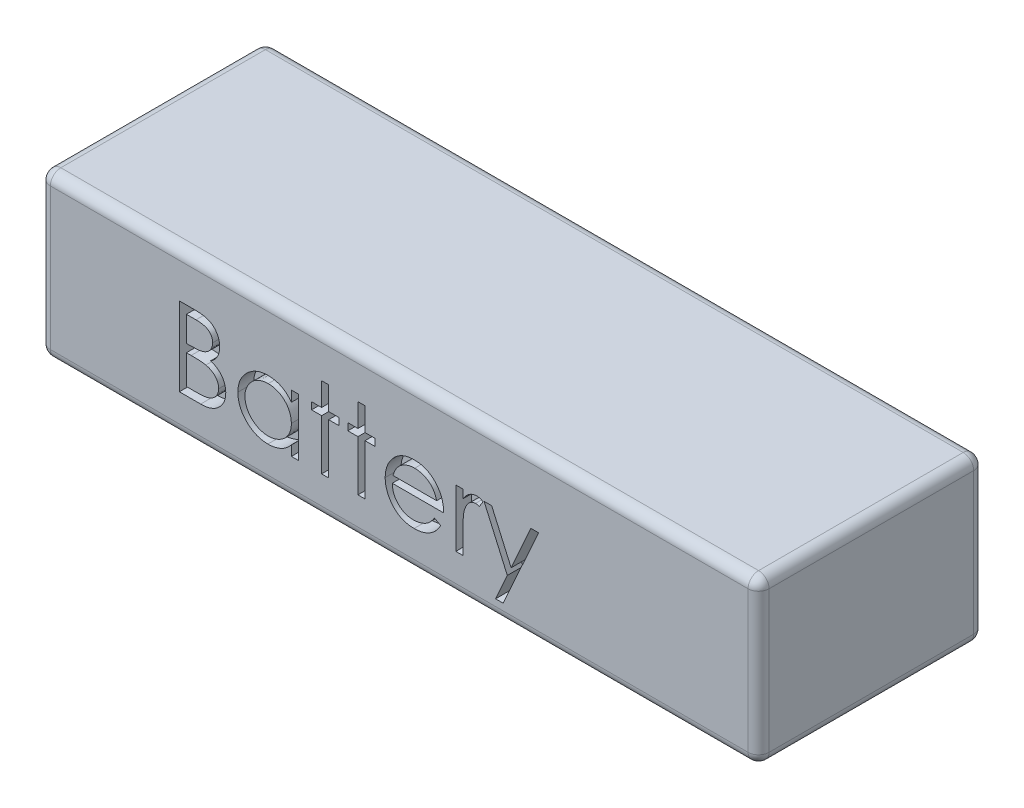
from build123d import *

# Parameters (mm, degrees)
SKETCH1_W           = 137
SKETCH1_H           = 43
BOSS_EXTRUDE1_DEPTH = 31
CUT_EXTRUDE1_DEPTH  = 3
CUT_EXTRUDE2_DEPTH  = 3
FILLET1_R           = 2


with BuildPart() as part:
    # Sketch1 → Boss-Extrude1 (new body)
    with BuildSketch(Plane(origin=(0, 0, 0), x_dir=(1, 0, 0), z_dir=(0, 1, 0))):
        with Locations((68.5, 21.5)):
            Rectangle(SKETCH1_W, SKETCH1_H)
    extrude(amount=BOSS_EXTRUDE1_DEPTH)

    # Sketch3 → Cut-Extrude1 (cut)
    # profile 1 of 7: a face of its own
    with BuildSketch(Plane.XY):
        with BuildLine():
            Line((26.597376063, 22.317205952), (29.524058756, 22.317205952))
            add(Edge.make_bspline(
                [(29.524058756, 22.317205952), (29.667323662, 22.316452736), (29.945006707, 22.314992816), (30.348804314, 22.292350825), (30.727013503, 22.261477954), (31.079743956, 22.212491843), (31.40683268, 22.153384227), (31.709265411, 22.081805015), (31.986080435, 21.995976671), (32.316563591, 21.859492608), (32.693366424, 21.65667903), (33.101359535, 21.356985179), (33.450234847, 20.99041748), (33.751033349, 20.576920385), (33.990181005, 20.122052792), (34.163192279, 19.636656269), (34.27272603, 19.12699166), (34.283990749, 18.777092327), (34.289683756, 18.600258837)],
                knots=[0, 0, 0, 0, 1.001505555, 1.941167018, 2.826882275, 3.653841531, 4.429895133, 5.150066043, 5.825578002, 6.45369114, 7.647487171, 8.808567382, 9.977351308, 11.170798116, 12.373658725, 13.556498008, 14.765093433, 16, 16, 16, 16], degree=3))
            add(Edge.make_bspline(
                [(34.289683756, 18.600258837), (34.284998534, 18.434605027), (34.275791631, 18.109079668), (34.187751234, 17.632962057), (34.049919798, 17.179742547), (33.858325873, 16.751075181), (33.609317318, 16.356645411), (33.314210238, 15.993271413), (32.958166798, 15.676338312), (32.691410055, 15.499154444), (32.555909717, 15.409153067)],
                knots=[0, 0, 0, 0, 1.044552857, 2.05264487, 3.044412934, 4.028983338, 5.005914585, 5.980388656, 6.974128949, 8, 8, 8, 8], degree=3))
            add(Edge.make_bspline(
                [(32.555909717, 15.409153067), (32.72631155, 15.343731643), (33.052332467, 15.218564253), (33.500986806, 14.997269407), (33.887536142, 14.756574649), (34.214952482, 14.493723862), (34.494971003, 14.210400387), (34.73948361, 13.902449898), (34.94811807, 13.565855221), (35.126887743, 13.204125784), (35.266382411, 12.820955205), (35.370850573, 12.419937593), (35.430711069, 12.002510928), (35.439229532, 11.718430731), (35.44352991, 11.575018452)],
                knots=[0, 0, 0, 0, 1.27268992, 2.434971085, 3.483601985, 4.442670788, 5.356604649, 6.2567628, 7.179492994, 8.113709626, 9.066344395, 10.018646069, 10.999752585, 12, 12, 12, 12], degree=3))
            add(Edge.make_bspline(
                [(35.44352991, 11.575018452), (35.439343427, 11.428589), (35.431106404, 11.140484951), (35.370335096, 10.71724866), (35.267438924, 10.312784603), (35.125705439, 9.924476677), (34.940724091, 9.553076101), (34.715604244, 9.198162112), (34.447183257, 8.863300696), (34.146913818, 8.544770882), (33.807218909, 8.258366079), (33.440722817, 8.003298765), (33.042810017, 7.793529927), (32.620015757, 7.617318407), (32.167597259, 7.482716128), (31.687586085, 7.388547954), (31.18039622, 7.325097795), (30.83235443, 7.319881203), (30.653866448, 7.317205952)],
                knots=[0, 0, 0, 0, 0.978564426, 1.925352924, 2.850884081, 3.763762016, 4.682927383, 5.618979971, 6.567305752, 7.547517671, 8.540179244, 9.531824382, 10.526200242, 11.540722885, 12.589160233, 13.674978461, 14.80764778, 16, 16, 16, 16], degree=3))
            Line((30.653866448, 7.317205952), (26.597376063, 7.317205952))
            Line((26.597376063, 7.317205952), (26.597376063, 22.317205952))
        make_face()
        with BuildLine():
            Line((27.94352991, 20.778744413), (27.94352991, 15.971052106))
            Line((27.94352991, 15.971052106), (28.847977025, 15.971052106))
            add(Edge.make_bspline(
                [(28.847977025, 15.971052106), (28.980186148, 15.972766062), (29.235641116, 15.976077773), (29.60558353, 15.985564275), (29.948976465, 16.012127318), (30.265227178, 16.038682727), (30.553837652, 16.081859531), (30.814168487, 16.133254344), (31.050305331, 16.187609651), (31.322617669, 16.280050309), (31.631501734, 16.416668917), (31.960786466, 16.628691072), (32.25107705, 16.881224015), (32.496207855, 17.172613851), (32.696828443, 17.493468933), (32.836172936, 17.838669849), (32.930661297, 18.199613272), (32.939196432, 18.447405784), (32.94352991, 18.573215567)],
                knots=[0, 0, 0, 0, 1.156816544, 2.235205308, 3.236616184, 4.169592532, 5.011045266, 5.787822928, 6.49130361, 7.128639758, 8.301311294, 9.436451833, 10.541879658, 11.654887649, 12.756523258, 13.837046038, 14.901820046, 16, 16, 16, 16], degree=3))
            add(Edge.make_bspline(
                [(32.94352991, 18.573215567), (32.941274852, 18.656468874), (32.936851309, 18.819779326), (32.90062287, 19.057847986), (32.83904755, 19.281749783), (32.759957722, 19.494553113), (32.649434771, 19.689603899), (32.519305642, 19.873646167), (32.362081255, 20.040412389), (32.183121344, 20.196281667), (31.977370103, 20.334472501), (31.744950281, 20.455504343), (31.482717379, 20.552964814), (31.195090858, 20.638319754), (30.87764334, 20.698269584), (30.534038111, 20.748212674), (30.161460744, 20.773638711), (29.903696019, 20.777004552), (29.770452986, 20.778744413)],
                knots=[0, 0, 0, 0, 0.91205012, 1.789085906, 2.630437955, 3.453916878, 4.269457761, 5.079663411, 5.91843418, 6.774407191, 7.675494373, 8.627863946, 9.638891023, 10.736472738, 11.911756761, 13.175263542, 14.539845004, 16, 16, 16, 16], degree=3))
            Line((29.770452986, 20.778744413), (27.94352991, 20.778744413))
        make_face(mode=Mode.SUBTRACT)
        with BuildLine():
            Line((27.94352991, 14.432590567), (27.94352991, 8.85566749))
            Line((27.94352991, 8.85566749), (29.860597217, 8.85566749))
            add(Edge.make_bspline(
                [(29.860597217, 8.85566749), (29.997821185, 8.857312122), (30.262302294, 8.860481933), (30.644164708, 8.870830024), (30.998092296, 8.894368348), (31.322470021, 8.93142199), (31.620800532, 8.971615343), (31.889504974, 9.02566369), (32.130761517, 9.087587807), (32.41050855, 9.183305688), (32.725523586, 9.332004849), (33.064998684, 9.556208676), (33.366825334, 9.823308567), (33.623133587, 10.132441056), (33.833189253, 10.468575314), (33.985998346, 10.824912528), (34.080244875, 11.195564789), (34.091654171, 11.448279271), (34.097376063, 11.575018452)],
                knots=[0, 0, 0, 0, 1.160039823, 2.235823828, 3.228722157, 4.157150951, 4.99529583, 5.772374946, 6.472645482, 7.099169577, 8.269452708, 9.405989375, 10.527446681, 11.663510218, 12.788923519, 13.866172445, 14.929861265, 16, 16, 16, 16], degree=3))
            add(Edge.make_bspline(
                [(34.097376063, 11.575018452), (34.096192759, 11.654275626), (34.093845237, 11.811511548), (34.058442602, 12.042579344), (34.006954589, 12.266404515), (33.9403913, 12.483594832), (33.843450727, 12.690223588), (33.73027982, 12.890377414), (33.597588099, 13.084320897), (33.390827388, 13.329516269), (33.090090311, 13.612017753), (32.662775559, 13.888607049), (32.176894282, 14.111669079), (31.824490741, 14.20638112), (31.642448179, 14.255306913)],
                knots=[0, 0, 0, 0, 0.723448775, 1.435228256, 2.130040452, 2.821711965, 3.505591119, 4.210454504, 4.921174351, 5.648778258, 7.137944449, 8.670945889, 10.280296675, 12, 12, 12, 12], degree=3))
            add(Edge.make_bspline(
                [(31.642448179, 14.255306913), (31.569466339, 14.270114416), (31.411226658, 14.302220136), (31.15319417, 14.336110294), (30.858611875, 14.366303407), (30.526799544, 14.38863694), (30.157337368, 14.411722127), (29.749436288, 14.420699932), (29.304762082, 14.431411046), (28.996223343, 14.432187336), (28.835957794, 14.432590567)],
                knots=[0, 0, 0, 0, 0.634451884, 1.375622551, 2.216452059, 3.157844607, 4.20941857, 5.370758133, 6.634282058, 8, 8, 8, 8], degree=3))
            Line((28.835957794, 14.432590567), (27.94352991, 14.432590567))
        make_face(mode=Mode.SUBTRACT)
    # profile 2 of 7: a face of its own
    with BuildSketch(Plane.XY):
        with BuildLine():
            Line((49.289683756, 18.278744413), (49.289683756, 7.317205952))
            Line((49.289683756, 7.317205952), (47.94352991, 7.317205952))
            Line((47.94352991, 7.317205952), (47.94352991, 9.213239606))
            add(Edge.make_bspline(
                [(47.94352991, 9.213239606), (47.791735093, 9.041641346), (47.495505599, 8.706765184), (47.00075795, 8.269270159), (46.476322902, 7.907648781), (45.924745811, 7.615577714), (45.346524768, 7.396183187), (44.742941537, 7.240242505), (44.113749905, 7.139983211), (43.684096956, 7.129971689), (43.466366448, 7.12489826)],
                knots=[0, 0, 0, 0, 1.074387032, 2.096679803, 3.090159297, 4.057316773, 5.018401886, 5.985159533, 6.978961417, 8, 8, 8, 8], degree=3))
            add(Edge.make_bspline(
                [(43.466366448, 7.12489826), (43.272789503, 7.130154141), (42.891047196, 7.140518971), (42.329494009, 7.220928844), (41.789098654, 7.350060079), (41.269350485, 7.52963532), (40.773612719, 7.767838841), (40.297640876, 8.053015619), (39.843900768, 8.392619176), (39.419308458, 8.780853583), (39.02831417, 9.202546386), (38.685194431, 9.652313015), (38.399109803, 10.128208603), (38.159880885, 10.624207834), (37.975610838, 11.144128918), (37.847152405, 11.686173923), (37.766836205, 12.249701953), (37.756475659, 12.633442766), (37.751222217, 12.82802326)],
                knots=[0, 0, 0, 0, 1.033919861, 2.038935746, 3.024066025, 3.998881131, 4.97069526, 5.957263378, 6.95902576, 7.993208707, 9.027059324, 10.027763471, 11.009749337, 11.988697705, 12.965288445, 13.950418724, 14.960734635, 16, 16, 16, 16], degree=3))
            add(Edge.make_bspline(
                [(37.751222217, 12.82802326), (37.756592095, 13.018581989), (37.767208052, 13.395306318), (37.84629328, 13.949357881), (37.979283317, 14.483007569), (38.16591695, 14.994537326), (38.405239614, 15.484566112), (38.696359987, 15.953440505), (39.039299093, 16.402452209), (39.434666552, 16.821043181), (39.862958424, 17.207702956), (40.321138699, 17.543741722), (40.797809905, 17.833956789), (41.300365664, 18.063900259), (41.821367542, 18.249939278), (42.365453738, 18.378651999), (42.930360504, 18.454497661), (43.313891184, 18.465480936), (43.508433756, 18.471052106)],
                knots=[0, 0, 0, 0, 1.020392517, 2.01726096, 2.990465484, 3.961182959, 4.928053699, 5.906110375, 6.912531644, 7.948652711, 8.985773172, 9.998621852, 10.987621588, 11.969261332, 12.953316658, 13.946091881, 14.958173133, 16, 16, 16, 16], degree=3))
            add(Edge.make_bspline(
                [(43.508433756, 18.471052106), (43.732147437, 18.464890313), (44.170839409, 18.45280733), (44.812530877, 18.352252784), (45.419578639, 18.182373639), (45.99666872, 17.951298647), (46.541728803, 17.644232666), (47.049598736, 17.256889976), (47.525593664, 16.79171346), (47.8015092, 16.434411555), (47.94352991, 16.250499221)],
                knots=[0, 0, 0, 0, 1.038897134, 2.037228247, 3.008116434, 3.962042015, 4.918381754, 5.904844433, 6.921570401, 8, 8, 8, 8], degree=3))
            Line((47.94352991, 16.250499221), (47.94352991, 18.278744413))
            Line((47.94352991, 18.278744413), (49.289683756, 18.278744413))
        make_face()
        with BuildLine():
            add(Edge.make_bspline(
                [(43.526462602, 17.12489826), (43.329686868, 17.117896955), (42.941282868, 17.104077493), (42.371094288, 16.996191086), (41.82546537, 16.816685681), (41.307125052, 16.571191819), (40.824261267, 16.262497233), (40.392716963, 15.889119877), (40.008962529, 15.461246959), (39.686212825, 14.980809343), (39.423110695, 14.465760381), (39.23810913, 13.927369932), (39.116098069, 13.3753486), (39.103632981, 13.000937089), (39.097376063, 12.812999221)],
                knots=[0, 0, 0, 0, 1.031046209, 2.035121221, 3.029706178, 4.034933723, 5.034054252, 6.02443088, 7.017295772, 8.038157696, 9.050218397, 10.03989886, 11.016116709, 12, 12, 12, 12], degree=3))
            add(Edge.make_bspline(
                [(39.097376063, 12.812999221), (39.105368463, 12.626184476), (39.121321936, 12.253287237), (39.235967769, 11.700513336), (39.428310083, 11.161996013), (39.690776067, 10.642306041), (40.01943303, 10.159802754), (40.400384398, 9.723773657), (40.837314175, 9.348818279), (41.321289205, 9.034942963), (41.838180507, 8.781389302), (42.381754499, 8.604965133), (42.941792948, 8.491060359), (43.322588665, 8.477755458), (43.514443371, 8.471052106)],
                knots=[0, 0, 0, 0, 0.979072187, 1.954306742, 2.945804271, 3.96968567, 4.997920485, 5.998718438, 6.996577872, 8.005894225, 9.015743152, 10.005417472, 10.995077863, 12, 12, 12, 12], degree=3))
            add(Edge.make_bspline(
                [(43.514443371, 8.471052106), (43.709214097, 8.478166237), (44.096593754, 8.492315538), (44.66847393, 8.600663818), (45.223452342, 8.779672954), (45.753969035, 9.027812068), (46.248181026, 9.335343594), (46.691743359, 9.695373984), (47.066811795, 10.114101916), (47.384780121, 10.574286714), (47.634103336, 11.078766699), (47.815715018, 11.615913231), (47.9230889, 12.185745009), (47.936622027, 12.575161839), (47.94352991, 12.773936721)],
                knots=[0, 0, 0, 0, 1.01762866, 2.023962475, 3.030623092, 4.058876274, 5.077231937, 6.066672613, 7.034107872, 8.005628644, 8.981990164, 9.965428785, 10.961468474, 12, 12, 12, 12], degree=3))
            add(Edge.make_bspline(
                [(47.94352991, 12.773936721), (47.939417097, 12.925384566), (47.931321779, 13.223481852), (47.869476481, 13.661171213), (47.771098225, 14.080030039), (47.632471782, 14.480498706), (47.450366277, 14.860363058), (47.230732995, 15.222350602), (46.969709639, 15.564578651), (46.671498084, 15.882334669), (46.345075788, 16.172162364), (45.999670614, 16.430866253), (45.631190269, 16.643389565), (45.24583154, 16.819280728), (44.842925821, 16.959248514), (44.419194593, 17.052624344), (43.979141792, 17.116740006), (43.678944411, 17.122150209), (43.526462602, 17.12489826)],
                knots=[0, 0, 0, 0, 1.050140795, 2.067009409, 3.05949893, 4.030605086, 5.00011959, 5.97591094, 6.962425594, 7.979863591, 8.993523472, 9.986985069, 10.967611495, 11.937549037, 12.921786183, 13.919465291, 14.943216303, 16, 16, 16, 16], degree=3))
        make_face(mode=Mode.SUBTRACT)
    # profile 3 of 7: a face of its own
    with BuildSketch(Plane.XY):
        Polygon((53.712760679, 22.701821337), (55.058914525, 22.701821337), (55.058914525, 18.278744413), (56.981991448, 18.278744413), (56.981991448, 16.932590567), (55.058914525, 16.932590567), (55.058914525, 7.317205952), (53.712760679, 7.317205952), (53.712760679, 16.932590567), (51.789683756, 16.932590567), (51.789683756, 18.278744413), (53.712760679, 18.278744413), align=None)
    # profile 4 of 7: a face of its own
    with BuildSketch(Plane.XY):
        Polygon((60.635837602, 22.701821337), (61.981991448, 22.701821337), (61.981991448, 18.278744413), (63.905068371, 18.278744413), (63.905068371, 16.932590567), (61.981991448, 16.932590567), (61.981991448, 7.317205952), (60.635837602, 7.317205952), (60.635837602, 16.932590567), (58.712760679, 16.932590567), (58.712760679, 18.278744413), (60.635837602, 18.278744413), align=None)
    # profile 5 of 7: a face of its own
    with BuildSketch(Plane.XY):
        with BuildLine():
            Line((75.20915491, 10.778744413), (76.405068371, 10.150739606))
            add(Edge.make_bspline(
                [(76.405068371, 10.150739606), (76.309768677, 9.981696757), (76.124353212, 9.652806317), (75.805492864, 9.200955486), (75.471241125, 8.794465276), (75.106509833, 8.444195329), (74.722211209, 8.13883225), (74.316214117, 7.871670144), (73.886404898, 7.644019343), (73.432763221, 7.452222795), (72.95147943, 7.304753534), (72.441387217, 7.200592587), (71.901509379, 7.13620715), (71.531454323, 7.128727976), (71.34196741, 7.12489826)],
                knots=[0, 0, 0, 0, 1.120438281, 2.179929193, 3.190490725, 4.156257408, 5.095198341, 6.022838206, 6.959905092, 7.901321166, 8.864066838, 9.862729781, 10.905609505, 12, 12, 12, 12], degree=3))
            add(Edge.make_bspline(
                [(71.34196741, 7.12489826), (71.131358934, 7.129814725), (70.720522813, 7.139405326), (70.122495325, 7.222087316), (69.559440675, 7.356968853), (69.031390518, 7.545392603), (68.539638007, 7.791509706), (68.083205772, 8.091336056), (67.659693518, 8.443331434), (67.282446907, 8.850544763), (66.942830267, 9.28632458), (66.643148182, 9.740421228), (66.392616334, 10.21169219), (66.188819433, 10.697137293), (66.024227155, 11.193696836), (65.90951271, 11.70588884), (65.843385219, 12.232327059), (65.833251881, 12.588458497), (65.828145294, 12.767927106)],
                knots=[0, 0, 0, 0, 1.145258523, 2.234067595, 3.276747158, 4.290159414, 5.277019952, 6.260822364, 7.254936242, 8.264827045, 9.274100331, 10.257902744, 11.220704747, 12.172965371, 13.118907548, 14.062713208, 15.023725156, 16, 16, 16, 16], degree=3))
            add(Edge.make_bspline(
                [(65.828145294, 12.767927106), (65.832684471, 12.936333522), (65.841680521, 13.270092799), (65.898383895, 13.76408799), (65.99887658, 14.244209929), (66.136775111, 14.710857564), (66.314851881, 15.163249566), (66.532704249, 15.601661268), (66.790671582, 16.025626153), (66.989840184, 16.293068154), (67.090164525, 16.427782875)],
                knots=[0, 0, 0, 0, 1.024358464, 2.0301432, 3.019427413, 4.004406732, 4.986367066, 5.972626655, 6.978780325, 8, 8, 8, 8], degree=3))
            add(Edge.make_bspline(
                [(67.090164525, 16.427782875), (67.226054594, 16.590078033), (67.493530079, 16.909527249), (67.94591446, 17.329262931), (68.435772444, 17.68087911), (68.956965127, 17.972338265), (69.515550016, 18.193796752), (70.104018406, 18.358829247), (70.729070919, 18.451306437), (71.156379008, 18.464368582), (71.375020294, 18.471052106)],
                knots=[0, 0, 0, 0, 1.030682036, 2.02871468, 2.997146059, 3.962720338, 4.930598197, 5.918074684, 6.934738563, 8, 8, 8, 8], degree=3))
            add(Edge.make_bspline(
                [(71.375020294, 18.471052106), (71.599795745, 18.465249039), (72.040753942, 18.453864745), (72.683748747, 18.348323316), (73.292151818, 18.180955225), (73.865719693, 17.944581837), (74.404510525, 17.63961233), (74.905022166, 17.261861581), (75.375814363, 16.822926921), (75.649708272, 16.485370309), (75.789082794, 16.313600183)],
                knots=[0, 0, 0, 0, 1.056321875, 2.072262726, 3.055038591, 4.01806755, 4.982017516, 5.957941055, 6.960871419, 8, 8, 8, 8], degree=3))
            add(Edge.make_bspline(
                [(75.789082794, 16.313600183), (75.88391253, 16.184156263), (76.072940786, 15.92613004), (76.309714072, 15.505396509), (76.515245765, 15.065208248), (76.679529883, 14.598449832), (76.812556317, 14.110651631), (76.908799826, 13.598326439), (76.965241048, 13.061626819), (76.976335465, 12.695941581), (76.981991448, 12.509513644)],
                knots=[0, 0, 0, 0, 0.94817472, 1.890038105, 2.849395472, 3.817997239, 4.812318967, 5.836947057, 6.897266129, 8, 8, 8, 8], degree=3))
            Line((76.981991448, 12.509513644), (67.17429914, 12.509513644))
            add(Edge.make_bspline(
                [(67.17429914, 12.509513644), (67.180897454, 12.365083083), (67.193872771, 12.08106621), (67.254366241, 11.66547714), (67.349718129, 11.269591388), (67.483728397, 10.89637835), (67.646014877, 10.540963518), (67.844810806, 10.20598336), (68.081980323, 9.89296366), (68.346519035, 9.599104499), (68.640978015, 9.337415522), (68.950761217, 9.103193624), (69.280305067, 8.906883924), (69.627011139, 8.747541539), (69.99031879, 8.622800184), (70.370342483, 8.537652382), (70.76633441, 8.480621924), (71.03627327, 8.474280501), (71.173698179, 8.471052106)],
                knots=[0, 0, 0, 0, 1.094153842, 2.151609401, 3.174256925, 4.172055639, 5.149267565, 6.128595816, 7.11444997, 8.118368179, 9.117203808, 10.09244225, 11.054858984, 12.015122123, 12.976791628, 13.957293641, 14.960065497, 16, 16, 16, 16], degree=3))
            add(Edge.make_bspline(
                [(71.173698179, 8.471052106), (71.30806024, 8.473658063), (71.574660344, 8.478828782), (71.97169259, 8.5291084), (72.362290564, 8.610409581), (72.744837635, 8.721366682), (73.111569832, 8.856696048), (73.451193618, 9.019994009), (73.763537399, 9.200635781), (74.055467256, 9.407248674), (74.338628656, 9.660140904), (74.619525027, 9.975722565), (74.920710684, 10.348954827), (75.10923751, 10.629864824), (75.20915491, 10.778744413)],
                knots=[0, 0, 0, 0, 0.99110716, 1.966546729, 2.947904876, 3.932708344, 4.903319531, 5.828989031, 6.710028674, 7.56322171, 8.463672341, 9.504779593, 10.677557249, 12, 12, 12, 12], degree=3))
        make_face()
        with BuildLine():
            add(Edge.make_bspline(
                [(75.635837602, 13.85566749), (75.586566354, 14.034222664), (75.491735062, 14.377883895), (75.293579214, 14.853773425), (75.070415468, 15.276721572), (74.806322334, 15.643491428), (74.507099224, 15.96922077), (74.161477013, 16.253871849), (73.773894612, 16.508518068), (73.346355438, 16.723457351), (72.89360493, 16.906413888), (72.419578393, 17.029092956), (71.935902159, 17.113133852), (71.608755218, 17.120960031), (71.444130871, 17.12489826)],
                knots=[0, 0, 0, 0, 1.154881502, 2.222775134, 3.210006277, 4.132804581, 5.035138423, 5.962687519, 6.919655026, 7.923214229, 8.944639381, 9.960483929, 10.97369054, 12, 12, 12, 12], degree=3))
            add(Edge.make_bspline(
                [(71.444130871, 17.12489826), (71.309776135, 17.12227681), (71.044185067, 17.117094756), (70.652894775, 17.067937059), (70.277124637, 16.986680581), (69.914101976, 16.875402195), (69.568583968, 16.727079613), (69.233463533, 16.553151499), (68.917261835, 16.340830425), (68.719513426, 16.179006762), (68.61961164, 16.097254029)],
                knots=[0, 0, 0, 0, 1.04873581, 2.073130211, 3.073294108, 4.04793562, 5.032784715, 6.005352987, 6.992311501, 8, 8, 8, 8], degree=3))
            add(Edge.make_bspline(
                [(68.61961164, 16.097254029), (68.548069003, 16.032564105), (68.403284142, 15.901647465), (68.209824765, 15.676093722), (68.024594167, 15.432872741), (67.85602137, 15.16267935), (67.701403142, 14.868590297), (67.556717526, 14.553086146), (67.426490045, 14.213772731), (67.353221002, 13.97731942), (67.315525102, 13.85566749)],
                knots=[0, 0, 0, 0, 0.879870761, 1.780643979, 2.707998968, 3.669668524, 4.684282772, 5.740141944, 6.837334558, 8, 8, 8, 8], degree=3))
            Line((67.315525102, 13.85566749), (75.635837602, 13.85566749))
        make_face(mode=Mode.SUBTRACT)
    # profile 6 of 7: a face of its own
    with BuildSketch(Plane.XY):
        with BuildLine():
            Line((79.289683756, 18.278744413), (80.635837602, 18.278744413))
            Line((80.635837602, 18.278744413), (80.635837602, 16.665162683))
            add(Edge.make_bspline(
                [(80.635837602, 16.665162683), (80.735217997, 16.815401947), (80.925282229, 17.102733373), (81.241194783, 17.482744662), (81.564780489, 17.797380577), (81.897588435, 18.048109943), (82.242066006, 18.235880452), (82.590652942, 18.373422031), (82.948833527, 18.454753382), (83.189527488, 18.46561192), (83.310116448, 18.471052106)],
                knots=[0, 0, 0, 0, 1.2804753, 2.448899062, 3.506932113, 4.484331642, 5.4025378, 6.288909075, 7.142734305, 8, 8, 8, 8], degree=3))
            add(Edge.make_bspline(
                [(83.310116448, 18.471052106), (83.403657847, 18.465949849), (83.596125355, 18.455451624), (83.887479312, 18.381690947), (84.187665534, 18.263927993), (84.381132908, 18.153184182), (84.481991448, 18.095451144)],
                knots=[0, 0, 0, 0, 0.901110191, 1.854092781, 2.881294221, 4, 4, 4, 4], degree=3))
            Line((84.481991448, 18.095451144), (83.742808756, 16.92958576))
            add(Edge.make_bspline(
                [(83.742808756, 16.92958576), (83.678055808, 16.958472614), (83.555142317, 17.013305395), (83.375337033, 17.078199724), (83.209559876, 17.116410792), (83.103944626, 17.122199581), (83.054707794, 17.12489826)],
                knots=[0, 0, 0, 0, 1.180555205, 2.24091978, 3.179933427, 4, 4, 4, 4], degree=3))
            add(Edge.make_bspline(
                [(83.054707794, 17.12489826), (82.946683222, 17.117698099), (82.726344408, 17.10301186), (82.40283941, 16.987559827), (82.088922815, 16.801023083), (81.839615691, 16.59414689), (81.646577464, 16.394656329), (81.508833641, 16.220448889), (81.382479011, 16.025111897), (81.261749495, 15.811984681), (81.151751091, 15.577428198), (81.049088223, 15.323785855), (80.956264525, 15.050763874), (80.903334907, 14.860553073), (80.876222217, 14.763119413)],
                knots=[0, 0, 0, 0, 1.125678352, 2.296057538, 3.5422874, 4.923748041, 5.663163013, 6.437101912, 7.23742474, 8.08941207, 8.991984279, 9.93940061, 10.944477711, 12, 12, 12, 12], degree=3))
            add(Edge.make_bspline(
                [(80.876222217, 14.763119413), (80.855940531, 14.676217241), (80.811018138, 14.483735533), (80.767340119, 14.160813284), (80.724185042, 13.779283318), (80.693770963, 13.338083634), (80.665579354, 12.838316017), (80.649679002, 12.279219107), (80.636379828, 11.660219031), (80.636023827, 11.227471803), (80.635837602, 11.001100183)],
                knots=[0, 0, 0, 0, 0.566838948, 1.255505196, 2.06880316, 3.007127437, 4.065329342, 5.249902469, 6.561414163, 8, 8, 8, 8], degree=3))
            Line((80.635837602, 11.001100183), (80.635837602, 7.317205952))
            Line((80.635837602, 7.317205952), (79.289683756, 7.317205952))
            Line((79.289683756, 7.317205952), (79.289683756, 18.278744413))
        make_face()
    # profile 7 of 7: a face of its own
    with BuildSketch(Plane.XY):
        Polygon((84.67429914, 18.278744413), (86.125621256, 18.278744413), (89.836558756, 9.883311721), (93.604587602, 18.278744413), (95.058914525, 18.278744413), (88.328145294, 3.278744413), (86.873818371, 3.278744413), (89.106390486, 8.251701144), align=None)
    extrude(amount=-CUT_EXTRUDE1_DEPTH, mode=Mode.SUBTRACT)

    # Sketch4 → Cut-Extrude2 (cut)
    # profile 1 of 7: a face of its own
    with BuildSketch(Plane(origin=(0, 0, -43), x_dir=(-1, 0, 0), z_dir=(0, 0, -1))):
        with BuildLine():
            Line((-98.616917961, 21.009959816), (-96.665796167, 21.009959816))
            add(Edge.make_bspline(
                [(-96.665796167, 21.009959816), (-96.570286229, 21.009457672), (-96.385164199, 21.008484392), (-96.115965794, 20.993389731), (-95.863826335, 20.972807817), (-95.6286727, 20.94015041), (-95.41061355, 20.900745332), (-95.208991729, 20.853025857), (-95.02444838, 20.795806961), (-94.804126276, 20.704817586), (-94.552924388, 20.569608534), (-94.28092898, 20.369812634), (-94.048345439, 20.125434167), (-93.847813104, 19.849769438), (-93.688381334, 19.546524376), (-93.573040484, 19.222926693), (-93.500017983, 18.883150288), (-93.492508171, 18.649884065), (-93.488712833, 18.531995072)],
                knots=[0, 0, 0, 0, 1.001505555, 1.941167018, 2.826882275, 3.653841531, 4.429895133, 5.150066043, 5.825578002, 6.45369114, 7.647487171, 8.808567382, 9.977351308, 11.170798116, 12.373658725, 13.556498008, 14.765093433, 16, 16, 16, 16], degree=3))
            add(Edge.make_bspline(
                [(-93.488712833, 18.531995072), (-93.491836314, 18.421559199), (-93.49797425, 18.204542293), (-93.556667848, 17.887130552), (-93.648555472, 17.584984213), (-93.776284755, 17.299205968), (-93.942290459, 17.036252788), (-94.139028512, 16.794003456), (-94.376390805, 16.582714722), (-94.554228633, 16.464592144), (-94.644562192, 16.404591226)],
                knots=[0, 0, 0, 0, 1.044552857, 2.05264487, 3.044412934, 4.028983338, 5.005914585, 5.980388656, 6.974128949, 8, 8, 8, 8], degree=3))
            add(Edge.make_bspline(
                [(-94.644562192, 16.404591226), (-94.53096097, 16.360976943), (-94.313613692, 16.277532016), (-94.0145108, 16.130002119), (-93.756811242, 15.969538947), (-93.538533682, 15.794305089), (-93.351854668, 15.605422773), (-93.188846264, 15.400122446), (-93.049756623, 15.175725995), (-92.930576842, 14.934573037), (-92.837580396, 14.679125984), (-92.767934955, 14.41178091), (-92.728027957, 14.133496466), (-92.722348982, 13.944109668), (-92.719482064, 13.848501482)],
                knots=[0, 0, 0, 0, 1.27268992, 2.434971085, 3.483601985, 4.442670788, 5.356604649, 6.2567628, 7.179492994, 8.113709626, 9.066344395, 10.018646069, 10.999752585, 12, 12, 12, 12], degree=3))
            add(Edge.make_bspline(
                [(-92.719482064, 13.848501482), (-92.722273053, 13.750881848), (-92.727764401, 13.558812482), (-92.768278606, 13.276654954), (-92.836876055, 13.00701225), (-92.931365044, 12.748140299), (-93.054685943, 12.500539915), (-93.204765841, 12.263930589), (-93.383713166, 12.040689645), (-93.583892791, 11.828336436), (-93.810356064, 11.6373999), (-94.054686793, 11.467355024), (-94.319961992, 11.327509132), (-94.601824832, 11.210034785), (-94.903437164, 11.120299933), (-95.223444614, 11.05752115), (-95.56157119, 11.015221044), (-95.793599051, 11.011743316), (-95.912591038, 11.009959816)],
                knots=[0, 0, 0, 0, 0.978564426, 1.925352924, 2.850884081, 3.763762016, 4.682927383, 5.618979971, 6.567305752, 7.547517671, 8.540179244, 9.531824382, 10.526200242, 11.540722885, 12.589160233, 13.674978461, 14.80764778, 16, 16, 16, 16], degree=3))
            Line((-95.912591038, 11.009959816), (-98.616917961, 11.009959816))
            Line((-98.616917961, 11.009959816), (-98.616917961, 21.009959816))
        make_face()
        with BuildLine():
            Line((-97.719482064, 19.98431879), (-97.719482064, 16.779190585))
            Line((-97.719482064, 16.779190585), (-97.11651732, 16.779190585))
            add(Edge.make_bspline(
                [(-97.11651732, 16.779190585), (-97.028377905, 16.780333222), (-96.858074593, 16.78254103), (-96.611446317, 16.788865364), (-96.382517694, 16.80657406), (-96.171683885, 16.824277666), (-95.979276902, 16.853062202), (-95.805723012, 16.88732541), (-95.648298449, 16.923562282), (-95.466756891, 16.985189387), (-95.260834181, 17.076268459), (-95.041311026, 17.217616562), (-94.84778397, 17.385971857), (-94.684363434, 17.580231748), (-94.550616375, 17.794135136), (-94.457720046, 18.02426908), (-94.394727806, 18.264898029), (-94.389037716, 18.430093037), (-94.386148731, 18.513966226)],
                knots=[0, 0, 0, 0, 1.156816544, 2.235205308, 3.236616184, 4.169592532, 5.011045266, 5.787822928, 6.49130361, 7.128639758, 8.301311294, 9.436451833, 10.541879658, 11.654887649, 12.756523258, 13.837046038, 14.901820046, 16, 16, 16, 16], degree=3))
            add(Edge.make_bspline(
                [(-94.386148731, 18.513966226), (-94.387652103, 18.56946843), (-94.390601131, 18.678342065), (-94.414753424, 18.837054505), (-94.455803637, 18.986322369), (-94.508530189, 19.128191256), (-94.582212157, 19.258225114), (-94.668964909, 19.380919959), (-94.773781167, 19.49209744), (-94.893087774, 19.596010292), (-95.030255268, 19.688137515), (-95.185201816, 19.76882541), (-95.360023751, 19.833799057), (-95.551774765, 19.89070235), (-95.763406444, 19.930668904), (-95.992476596, 19.963964297), (-96.240861508, 19.980914989), (-96.412704658, 19.983158882), (-96.501533346, 19.98431879)],
                knots=[0, 0, 0, 0, 0.91205012, 1.789085906, 2.630437955, 3.453916878, 4.269457761, 5.079663411, 5.91843418, 6.774407191, 7.675494373, 8.627863946, 9.638891023, 10.736472738, 11.911756761, 13.175263542, 14.539845004, 16, 16, 16, 16], degree=3))
            Line((-96.501533346, 19.98431879), (-97.719482064, 19.98431879))
        make_face(mode=Mode.SUBTRACT)
        with BuildLine():
            Line((-97.719482064, 15.753549559), (-97.719482064, 12.035600841))
            Line((-97.719482064, 12.035600841), (-96.441437192, 12.035600841))
            add(Edge.make_bspline(
                [(-96.441437192, 12.035600841), (-96.349954547, 12.036697262), (-96.173633808, 12.03881047), (-95.919058865, 12.045709197), (-95.68310714, 12.061401413), (-95.466855323, 12.086103841), (-95.267968316, 12.11289941), (-95.088832021, 12.148931641), (-94.927994326, 12.190214385), (-94.741496304, 12.254026306), (-94.53148628, 12.35315908), (-94.305169547, 12.502628298), (-94.103951781, 12.680694892), (-93.933079612, 12.886783218), (-93.793042502, 13.110872724), (-93.691169773, 13.348430867), (-93.628338754, 13.595532373), (-93.620732556, 13.764008695), (-93.616917961, 13.848501482)],
                knots=[0, 0, 0, 0, 1.160039823, 2.235823828, 3.228722157, 4.157150951, 4.99529583, 5.772374946, 6.472645482, 7.099169577, 8.269452708, 9.405989375, 10.527446681, 11.663510218, 12.788923519, 13.866172445, 14.929861265, 16, 16, 16, 16], degree=3))
            add(Edge.make_bspline(
                [(-93.616917961, 13.848501482), (-93.617706831, 13.901339598), (-93.619271845, 14.006163546), (-93.642873602, 14.160208744), (-93.677198945, 14.309425525), (-93.72157447, 14.454219069), (-93.786201519, 14.591971573), (-93.86164879, 14.725407457), (-93.950109938, 14.854703112), (-94.087950412, 15.018166694), (-94.288441796, 15.206501016), (-94.573318297, 15.39089388), (-94.897239149, 15.5396019), (-95.132174843, 15.602743261), (-95.253536551, 15.635360457)],
                knots=[0, 0, 0, 0, 0.723448775, 1.435228256, 2.130040452, 2.821711965, 3.505591119, 4.210454504, 4.921174351, 5.648778258, 7.137944449, 8.670945889, 10.280296675, 12, 12, 12, 12], degree=3))
            add(Edge.make_bspline(
                [(-95.253536551, 15.635360457), (-95.302191111, 15.645232125), (-95.407684232, 15.666635938), (-95.57970589, 15.689229377), (-95.776094087, 15.709358119), (-95.997302308, 15.724247141), (-96.243610425, 15.739637266), (-96.515544478, 15.745622469), (-96.811993949, 15.752763212), (-97.017686441, 15.753280738), (-97.124530141, 15.753549559)],
                knots=[0, 0, 0, 0, 0.634451884, 1.375622551, 2.216452059, 3.157844607, 4.20941857, 5.370758133, 6.634282058, 8, 8, 8, 8], degree=3))
            Line((-97.124530141, 15.753549559), (-97.719482064, 15.753549559))
        make_face(mode=Mode.SUBTRACT)
    # profile 2 of 7: a face of its own
    with BuildSketch(Plane(origin=(0, 0, -43), x_dir=(-1, 0, 0), z_dir=(0, 0, -1))):
        with BuildLine():
            Line((-83.488712833, 18.317652123), (-83.488712833, 11.009959816))
            Line((-83.488712833, 11.009959816), (-84.386148731, 11.009959816))
            Line((-84.386148731, 11.009959816), (-84.386148731, 12.273982251))
            add(Edge.make_bspline(
                [(-84.386148731, 12.273982251), (-84.487345275, 12.159583412), (-84.684831605, 11.936332637), (-85.01466337, 11.644669287), (-85.364286736, 11.403588368), (-85.732004796, 11.208874324), (-86.117485491, 11.062611305), (-86.519874312, 10.958650851), (-86.9393354, 10.891811322), (-87.2257707, 10.885136974), (-87.370924372, 10.881754687)],
                knots=[0, 0, 0, 0, 1.074387032, 2.096679803, 3.090159297, 4.057316773, 5.018401886, 5.985159533, 6.978961417, 8, 8, 8, 8], degree=3))
            add(Edge.make_bspline(
                [(-87.370924372, 10.881754687), (-87.499975668, 10.885258608), (-87.754470539, 10.892168495), (-88.128839331, 10.945775077), (-88.489102901, 11.031862567), (-88.83560168, 11.151579394), (-89.166093524, 11.310381742), (-89.483408086, 11.500499593), (-89.785901492, 11.726901965), (-90.068963032, 11.985724903), (-90.32962589, 12.266853438), (-90.558372383, 12.566697858), (-90.749095469, 12.883961583), (-90.908581413, 13.214627737), (-91.031428112, 13.561241793), (-91.117067067, 13.92260513), (-91.1706112, 14.298290483), (-91.177518231, 14.554117692), (-91.181020525, 14.683838021)],
                knots=[0, 0, 0, 0, 1.033919861, 2.038935746, 3.024066025, 3.998881131, 4.97069526, 5.957263378, 6.95902576, 7.993208707, 9.027059324, 10.027763471, 11.009749337, 11.988697705, 12.965288445, 13.950418724, 14.960734635, 16, 16, 16, 16], degree=3))
            add(Edge.make_bspline(
                [(-91.181020525, 14.683838021), (-91.177440607, 14.810877174), (-91.170363302, 15.062026726), (-91.117639817, 15.431394435), (-91.028979792, 15.787160894), (-90.90455737, 16.128180732), (-90.745008927, 16.454866589), (-90.550928679, 16.767449518), (-90.322302608, 17.066790653), (-90.058724302, 17.345851301), (-89.773196388, 17.603624485), (-89.467742871, 17.827650329), (-89.149962067, 18.02112704), (-88.814924894, 18.174422687), (-88.467590309, 18.2984487), (-88.104866178, 18.38425718), (-87.728261668, 18.434820955), (-87.472574547, 18.442143138), (-87.3428795, 18.445857251)],
                knots=[0, 0, 0, 0, 1.020392517, 2.01726096, 2.990465484, 3.961182959, 4.928053699, 5.906110375, 6.912531644, 7.948652711, 8.985773172, 9.998621852, 10.987621588, 11.969261332, 12.953316658, 13.946091881, 14.958173133, 16, 16, 16, 16], degree=3))
            add(Edge.make_bspline(
                [(-87.3428795, 18.445857251), (-87.193737045, 18.44174939), (-86.901275731, 18.433694067), (-86.473481419, 18.366657704), (-86.068782911, 18.25340494), (-85.684056191, 18.099354946), (-85.320682802, 17.894644291), (-84.982102847, 17.636415831), (-84.664772894, 17.326298154), (-84.480829204, 17.088096884), (-84.386148731, 16.965488662)],
                knots=[0, 0, 0, 0, 1.038897134, 2.037228247, 3.008116434, 3.962042015, 4.918381754, 5.904844433, 6.921570401, 8, 8, 8, 8], degree=3))
            Line((-84.386148731, 16.965488662), (-84.386148731, 18.317652123))
            Line((-84.386148731, 18.317652123), (-83.488712833, 18.317652123))
        make_face()
        with BuildLine():
            add(Edge.make_bspline(
                [(-87.330860269, 17.548421354), (-87.462044092, 17.543753818), (-87.720980091, 17.534540843), (-88.101105812, 17.462616571), (-88.464858423, 17.342946302), (-88.810418636, 17.179283727), (-89.132327826, 16.973487337), (-89.420024028, 16.724569099), (-89.675860318, 16.439320487), (-89.891026787, 16.119028743), (-90.066428207, 15.775662768), (-90.189762584, 15.416735802), (-90.271103291, 15.048721581), (-90.279413349, 14.799113907), (-90.283584628, 14.673821995)],
                knots=[0, 0, 0, 0, 1.031046209, 2.035121221, 3.029706178, 4.034933723, 5.034054252, 6.02443088, 7.017295772, 8.038157696, 9.050218397, 10.03989886, 11.016116709, 12, 12, 12, 12], degree=3))
            add(Edge.make_bspline(
                [(-90.283584628, 14.673821995), (-90.278256361, 14.549278832), (-90.267620713, 14.300680672), (-90.191190158, 13.932164738), (-90.062961948, 13.57315319), (-89.887984626, 13.226693208), (-89.668879984, 12.90502435), (-89.414912405, 12.614338286), (-89.123625887, 12.364368033), (-88.800975867, 12.155117823), (-88.456381666, 11.986082049), (-88.093999004, 11.868465936), (-87.720640038, 11.79252942), (-87.466776227, 11.783659486), (-87.33887309, 11.779190585)],
                knots=[0, 0, 0, 0, 0.979072187, 1.954306742, 2.945804271, 3.96968567, 4.997920485, 5.998718438, 6.996577872, 8.005894225, 9.015743152, 10.005417472, 10.995077863, 12, 12, 12, 12], degree=3))
            add(Edge.make_bspline(
                [(-87.33887309, 11.779190585), (-87.209025939, 11.783933339), (-86.950772834, 11.793366206), (-86.569519383, 11.865598393), (-86.199533775, 11.984937817), (-85.84585598, 12.150363893), (-85.51638132, 12.35538491), (-85.220673098, 12.59540517), (-84.970627474, 12.874557125), (-84.758648589, 13.181346991), (-84.592433113, 13.51766698), (-84.471358658, 13.875764668), (-84.39977607, 14.25565252), (-84.390753986, 14.51526374), (-84.386148731, 14.647780328)],
                knots=[0, 0, 0, 0, 1.01762866, 2.023962475, 3.030623092, 4.058876274, 5.077231937, 6.066672613, 7.034107872, 8.005628644, 8.981990164, 9.965428785, 10.961468474, 12, 12, 12, 12], degree=3))
            add(Edge.make_bspline(
                [(-84.386148731, 14.647780328), (-84.388890606, 14.748745558), (-84.394287484, 14.947477082), (-84.435517683, 15.23926999), (-84.501103187, 15.518509207), (-84.593520816, 15.785488318), (-84.714924485, 16.03873122), (-84.861346674, 16.280056249), (-85.035362244, 16.508208281), (-85.234169947, 16.720045627), (-85.451784812, 16.913264091), (-85.682054928, 17.08573335), (-85.927708491, 17.227415558), (-86.18461431, 17.344676333), (-86.453218123, 17.43798819), (-86.735705608, 17.500238744), (-87.029074142, 17.542982518), (-87.229205729, 17.54658932), (-87.330860269, 17.548421354)],
                knots=[0, 0, 0, 0, 1.050140795, 2.067009409, 3.05949893, 4.030605086, 5.00011959, 5.97591094, 6.962425594, 7.979863591, 8.993523472, 9.986985069, 10.967611495, 11.937549037, 12.921786183, 13.919465291, 14.943216303, 16, 16, 16, 16], degree=3))
        make_face(mode=Mode.SUBTRACT)
    # profile 3 of 7: a face of its own
    with BuildSketch(Plane(origin=(0, 0, -43), x_dir=(-1, 0, 0), z_dir=(0, 0, -1))):
        Polygon((-80.539994884, 21.266370072), (-79.642558987, 21.266370072), (-79.642558987, 18.317652123), (-78.360507705, 18.317652123), (-78.360507705, 17.420216226), (-79.642558987, 17.420216226), (-79.642558987, 11.009959816), (-80.539994884, 11.009959816), (-80.539994884, 17.420216226), (-81.822046167, 17.420216226), (-81.822046167, 18.317652123), (-80.539994884, 18.317652123), align=None)
    # profile 4 of 7: a face of its own
    with BuildSketch(Plane(origin=(0, 0, -43), x_dir=(-1, 0, 0), z_dir=(0, 0, -1))):
        Polygon((-75.924610269, 21.266370072), (-75.027174372, 21.266370072), (-75.027174372, 18.317652123), (-73.74512309, 18.317652123), (-73.74512309, 17.420216226), (-75.027174372, 17.420216226), (-75.027174372, 11.009959816), (-75.924610269, 11.009959816), (-75.924610269, 17.420216226), (-77.206661551, 17.420216226), (-77.206661551, 18.317652123), (-75.924610269, 18.317652123), align=None)
    # profile 5 of 7: a face of its own
    with BuildSketch(Plane(origin=(0, 0, -43), x_dir=(-1, 0, 0), z_dir=(0, 0, -1))):
        with BuildLine():
            Line((-66.209065397, 13.317652123), (-65.411789756, 12.898982251))
            add(Edge.make_bspline(
                [(-65.411789756, 12.898982251), (-65.475322886, 12.786287019), (-65.598933195, 12.567026725), (-65.811506761, 12.265792838), (-66.034341254, 11.994799365), (-66.277495448, 11.761286067), (-66.533694531, 11.557710681), (-66.804359259, 11.37960261), (-67.090898738, 11.227835409), (-67.393326523, 11.099971044), (-67.714182384, 11.001658204), (-68.054243859, 10.932217573), (-68.414162417, 10.889293948), (-68.660865788, 10.884307831), (-68.787190397, 10.881754687)],
                knots=[0, 0, 0, 0, 1.120438281, 2.179929193, 3.190490725, 4.156257408, 5.095198341, 6.022838206, 6.959905092, 7.901321166, 8.864066838, 9.862729781, 10.905609505, 12, 12, 12, 12], degree=3))
            add(Edge.make_bspline(
                [(-68.787190397, 10.881754687), (-68.927596047, 10.885032331), (-69.201486795, 10.891426065), (-69.600171787, 10.946547392), (-69.975541554, 11.036468416), (-70.327574992, 11.162084249), (-70.655409999, 11.326162318), (-70.959698156, 11.526046552), (-71.242039658, 11.760710137), (-71.493537399, 12.032185689), (-71.719948492, 12.322705567), (-71.919736549, 12.625436666), (-72.086757781, 12.939617307), (-72.222622381, 13.263247376), (-72.332350567, 13.594287072), (-72.408826863, 13.935748408), (-72.452911858, 14.28670722), (-72.459667416, 14.524128179), (-72.463071808, 14.643773918)],
                knots=[0, 0, 0, 0, 1.145258523, 2.234067595, 3.276747158, 4.290159414, 5.277019952, 6.260822364, 7.254936242, 8.264827045, 9.274100331, 10.257902744, 11.220704747, 12.172965371, 13.118907548, 14.062713208, 15.023725156, 16, 16, 16, 16], degree=3))
            add(Edge.make_bspline(
                [(-72.463071808, 14.643773918), (-72.460045689, 14.756044862), (-72.454048323, 14.978551047), (-72.416246073, 15.307881174), (-72.34925095, 15.627962467), (-72.257318596, 15.93906089), (-72.13860075, 16.240655558), (-71.993365838, 16.532930026), (-71.821387616, 16.815573283), (-71.688608548, 16.99386795), (-71.621725654, 17.083677764)],
                knots=[0, 0, 0, 0, 1.024358464, 2.0301432, 3.019427413, 4.004406732, 4.986367066, 5.972626655, 6.978780325, 8, 8, 8, 8], degree=3))
            add(Edge.make_bspline(
                [(-71.621725654, 17.083677764), (-71.531132274, 17.191874536), (-71.352815284, 17.40484068), (-71.051225697, 17.684664468), (-70.724653708, 17.919075254), (-70.377191919, 18.113381358), (-70.004801993, 18.261020349), (-69.612489733, 18.371042012), (-69.195788058, 18.432693473), (-68.910915998, 18.441401569), (-68.765155141, 18.445857251)],
                knots=[0, 0, 0, 0, 1.030682036, 2.02871468, 2.997146059, 3.962720338, 4.930598197, 5.918074684, 6.934738563, 8, 8, 8, 8], degree=3))
            add(Edge.make_bspline(
                [(-68.765155141, 18.445857251), (-68.61530484, 18.44198854), (-68.321332709, 18.434399011), (-67.892669506, 18.364038058), (-67.487067459, 18.252459331), (-67.104688875, 18.094877073), (-66.745494987, 17.891564067), (-66.41182056, 17.639730235), (-66.097959095, 17.347107128), (-65.915363156, 17.122069387), (-65.822446808, 17.007555969)],
                knots=[0, 0, 0, 0, 1.056321875, 2.072262726, 3.055038591, 4.01806755, 4.982017516, 5.957941055, 6.960871419, 8, 8, 8, 8], degree=3))
            add(Edge.make_bspline(
                [(-65.822446808, 17.007555969), (-65.759226984, 16.921260023), (-65.633208146, 16.749242541), (-65.475359289, 16.46875352), (-65.338338161, 16.175294679), (-65.228815415, 15.864122402), (-65.140131126, 15.538923601), (-65.075968786, 15.197373474), (-65.038341305, 14.839573727), (-65.030945027, 14.595783568), (-65.027174372, 14.471498277)],
                knots=[0, 0, 0, 0, 0.94817472, 1.890038105, 2.849395472, 3.817997239, 4.812318967, 5.836947057, 6.897266129, 8, 8, 8, 8], degree=3))
            Line((-65.027174372, 14.471498277), (-71.56563591, 14.471498277))
            add(Edge.make_bspline(
                [(-71.56563591, 14.471498277), (-71.561237035, 14.375211236), (-71.552586823, 14.185866654), (-71.512257843, 13.908807274), (-71.448689918, 13.644883439), (-71.359349739, 13.396074748), (-71.251158752, 13.159131526), (-71.118628133, 12.935811421), (-70.960515122, 12.727131621), (-70.784155981, 12.531225513), (-70.587849994, 12.356766196), (-70.381327859, 12.200618264), (-70.161631959, 12.06974513), (-69.930494578, 11.963516874), (-69.688289477, 11.880355971), (-69.434940348, 11.823590769), (-69.17094573, 11.785570463), (-68.99098649, 11.781342848), (-68.899369884, 11.779190585)],
                knots=[0, 0, 0, 0, 1.094153842, 2.151609401, 3.174256925, 4.172055639, 5.149267565, 6.128595816, 7.11444997, 8.118368179, 9.117203808, 10.09244225, 11.054858984, 12.015122123, 12.976791628, 13.957293641, 14.960065497, 16, 16, 16, 16], degree=3))
            add(Edge.make_bspline(
                [(-68.899369884, 11.779190585), (-68.809795177, 11.78092789), (-68.632061774, 11.784375035), (-68.367373611, 11.817894781), (-68.106974961, 11.872095568), (-67.85194358, 11.946066969), (-67.607455449, 12.036286546), (-67.381039592, 12.145151854), (-67.172810404, 12.265579701), (-66.9781905, 12.40332163), (-66.789416233, 12.57191645), (-66.602151986, 12.782304224), (-66.401361548, 13.031125732), (-66.275676997, 13.218399064), (-66.209065397, 13.317652123)],
                knots=[0, 0, 0, 0, 0.99110716, 1.966546729, 2.947904876, 3.932708344, 4.903319531, 5.828989031, 6.710028674, 7.56322171, 8.463672341, 9.504779593, 10.677557249, 12, 12, 12, 12], degree=3))
        make_face()
        with BuildLine():
            add(Edge.make_bspline(
                [(-65.924610269, 15.368934175), (-65.957457768, 15.487970957), (-66.020678629, 15.717078444), (-66.152782528, 16.034338131), (-66.301558358, 16.316303562), (-66.477620448, 16.5608168), (-66.677102521, 16.777969694), (-66.907517329, 16.96773708), (-67.165905596, 17.137501226), (-67.450931712, 17.280794082), (-67.752765384, 17.402765107), (-68.068783075, 17.484551152), (-68.391233897, 17.540578415), (-68.609331858, 17.545795868), (-68.719081423, 17.548421354)],
                knots=[0, 0, 0, 0, 1.154881502, 2.222775134, 3.210006277, 4.132804581, 5.035138423, 5.962687519, 6.919655026, 7.923214229, 8.944639381, 9.960483929, 10.97369054, 12, 12, 12, 12], degree=3))
            add(Edge.make_bspline(
                [(-68.719081423, 17.548421354), (-68.808651247, 17.546673721), (-68.985711959, 17.543219018), (-69.246572154, 17.51044722), (-69.497085579, 17.456276235), (-69.739100687, 17.382090644), (-69.969446025, 17.283208923), (-70.192859648, 17.167256847), (-70.40366078, 17.025709465), (-70.535493053, 16.917827022), (-70.602094243, 16.8633252)],
                knots=[0, 0, 0, 0, 1.04873581, 2.073130211, 3.073294108, 4.04793562, 5.032784715, 6.005352987, 6.992311501, 8, 8, 8, 8], degree=3))
            add(Edge.make_bspline(
                [(-70.602094243, 16.8633252), (-70.649789335, 16.820198584), (-70.746312575, 16.732920824), (-70.875285494, 16.582551662), (-70.998772559, 16.420404342), (-71.111154424, 16.240275414), (-71.214233242, 16.044216046), (-71.31069032, 15.833879945), (-71.39750864, 15.607671002), (-71.446354669, 15.450035461), (-71.471485269, 15.368934175)],
                knots=[0, 0, 0, 0, 0.879870761, 1.780643979, 2.707998968, 3.669668524, 4.684282772, 5.740141944, 6.837334558, 8, 8, 8, 8], degree=3))
            Line((-71.471485269, 15.368934175), (-65.924610269, 15.368934175))
        make_face(mode=Mode.SUBTRACT)
    # profile 6 of 7: a face of its own
    with BuildSketch(Plane(origin=(0, 0, -43), x_dir=(-1, 0, 0), z_dir=(0, 0, -1))):
        with BuildLine():
            Line((-63.488712833, 18.317652123), (-62.591276936, 18.317652123))
            Line((-62.591276936, 18.317652123), (-62.591276936, 17.241930969))
            add(Edge.make_bspline(
                [(-62.591276936, 17.241930969), (-62.525023339, 17.342090479), (-62.398313851, 17.533644763), (-62.187705481, 17.786985623), (-61.971981678, 17.996742899), (-61.750109714, 18.163895809), (-61.520458, 18.289076149), (-61.288066709, 18.380770535), (-61.049279653, 18.434991435), (-60.888817012, 18.442230461), (-60.808424372, 18.445857251)],
                knots=[0, 0, 0, 0, 1.2804753, 2.448899062, 3.506932113, 4.484331642, 5.4025378, 6.288909075, 7.142734305, 8, 8, 8, 8], degree=3))
            add(Edge.make_bspline(
                [(-60.808424372, 18.445857251), (-60.746063439, 18.442455747), (-60.617751767, 18.43545693), (-60.423515796, 18.386283146), (-60.223391648, 18.30777451), (-60.094413398, 18.233945302), (-60.027174372, 18.19545661)],
                knots=[0, 0, 0, 0, 0.901110191, 1.854092781, 2.881294221, 4, 4, 4, 4], degree=3))
            Line((-60.027174372, 18.19545661), (-60.519962833, 17.418213021))
            add(Edge.make_bspline(
                [(-60.519962833, 17.418213021), (-60.563131465, 17.437470924), (-60.645073792, 17.474026111), (-60.764943982, 17.517288997), (-60.875462087, 17.542763042), (-60.945872253, 17.546622235), (-60.978696808, 17.548421354)],
                knots=[0, 0, 0, 0, 1.180555205, 2.24091978, 3.179933427, 4, 4, 4, 4], degree=3))
            add(Edge.make_bspline(
                [(-60.978696808, 17.548421354), (-61.050713189, 17.543621247), (-61.197605732, 17.533830421), (-61.41327573, 17.456862399), (-61.62255346, 17.33250457), (-61.78875821, 17.194587107), (-61.917450361, 17.0615934), (-62.009279576, 16.945455107), (-62.093515996, 16.815230446), (-62.17400234, 16.673145635), (-62.24733461, 16.516774646), (-62.315776522, 16.347679751), (-62.377658987, 16.165665097), (-62.412945399, 16.038857896), (-62.431020525, 15.973902123)],
                knots=[0, 0, 0, 0, 1.125678352, 2.296057538, 3.5422874, 4.923748041, 5.663163013, 6.437101912, 7.23742474, 8.08941207, 8.991984279, 9.93940061, 10.944477711, 12, 12, 12, 12], degree=3))
            add(Edge.make_bspline(
                [(-62.431020525, 15.973902123), (-62.444541649, 15.915967342), (-62.474489911, 15.787646203), (-62.503608591, 15.572364703), (-62.532378642, 15.318011393), (-62.552654695, 15.02387827), (-62.571449101, 14.690699859), (-62.582049336, 14.317968586), (-62.590915452, 13.905301868), (-62.591152786, 13.616803716), (-62.591276936, 13.465889303)],
                knots=[0, 0, 0, 0, 0.566838948, 1.255505196, 2.06880316, 3.007127437, 4.065329342, 5.249902469, 6.561414163, 8, 8, 8, 8], degree=3))
            Line((-62.591276936, 13.465889303), (-62.591276936, 11.009959816))
            Line((-62.591276936, 11.009959816), (-63.488712833, 11.009959816))
            Line((-63.488712833, 11.009959816), (-63.488712833, 18.317652123))
        make_face()
    # profile 7 of 7: a face of its own
    with BuildSketch(Plane(origin=(0, 0, -43), x_dir=(-1, 0, 0), z_dir=(0, 0, -1))):
        Polygon((-59.898969243, 18.317652123), (-58.931421167, 18.317652123), (-56.457462833, 12.720696995), (-53.945443602, 18.317652123), (-52.97589232, 18.317652123), (-57.463071808, 8.317652123), (-58.43262309, 8.317652123), (-56.944241679, 11.63295661), align=None)
    extrude(amount=-CUT_EXTRUDE2_DEPTH, mode=Mode.SUBTRACT)

    # Fillet1
    fillet1_edges = [part.edges().sort_by_distance(p)[0] for p in [
        (137, 31, -21.5),
        (68.5, 31, -43),
        (0, 31, -21.5),
        (68.5, 0, -43),
        (137, 0, -21.5),
        (68.5, 0, 0),
        (0, 0, -21.5),
        (0, 15.5, -43),
        (137, 15.5, -43),
        (137, 15.5, 0),
        (0, 15.5, 0),
        (68.5, 31, 0),
    ]]
    fillet(fillet1_edges, radius=FILLET1_R)


solid = part.part
